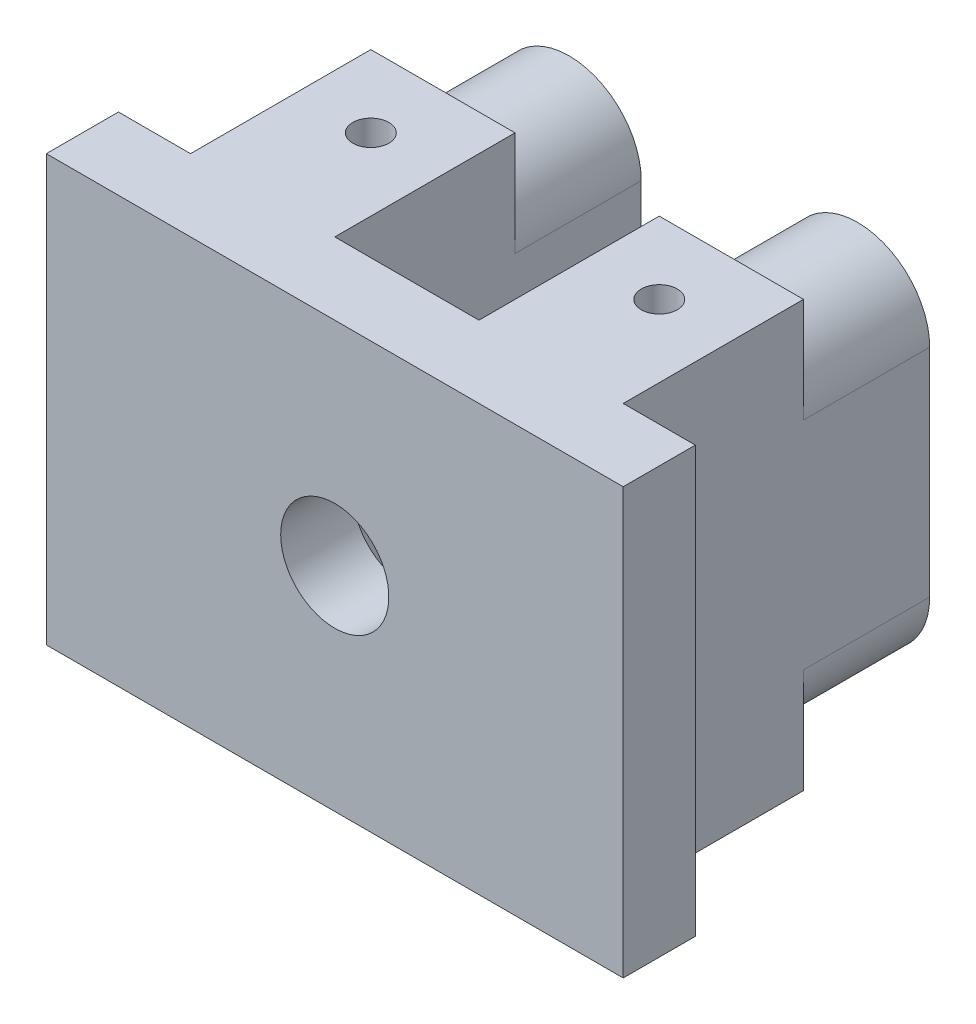
from build123d import *

# Parameters (mm, degrees)
BOSS_EXTRUDE1_DEPTH     = 11.8
BOSS_EXTRUDE2_DEPTH     = 10.5
CUT_EXTRUDE1_DEPTH      = 18.705648816
CUT_EXTRUDE1_DEPTH_BACK = 18.705648816
SKETCH2_R               = 0.5
SKETCH5_R               = 1.1
CUT_EXTRUDE2_DEPTH      = 1
CUT_EXTRUDE3_DEPTH      = 17.597891432
CUT_EXTRUDE3_DEPTH_BACK = 17.597891432
SKETCH6_R               = 1.5


with BuildPart() as part:
    # Sketch1 → Boss-Extrude1 (new body)
    with BuildSketch(Plane(origin=(0, 0, 0), x_dir=(1, 0, 0), z_dir=(0, 1, 0))):
        Polygon((0, 0), (8, 0), (8, 2), (6, 2), (6, 7), (2, 7), (2, 2), (-2, 2), (-2, 7), (-6, 7), (-6, 2), (-8, 2), (-8, 0), align=None)
    extrude(amount=BOSS_EXTRUDE1_DEPTH)

    # Sketch4 → Boss-Extrude2 (add)
    with BuildSketch(Plane.XY):
        with BuildLine():
            Line((-2, 8.9), (-2, 2.9))
            ThreePointArc((-2, 2.9), (-4, 0.9), (-6, 2.9))
            Line((-6, 2.9), (-6, 8.9))
            ThreePointArc((-6, 8.9), (-4, 10.9), (-2, 8.9))
        make_face()
        with BuildLine():
            Line((6, 8.9), (6, 2.9))
            ThreePointArc((6, 2.9), (4, 0.9), (2, 2.9))
            Line((2, 2.9), (2, 8.9))
            ThreePointArc((2, 8.9), (4, 10.9), (6, 8.9))
        make_face()
    extrude(amount=-BOSS_EXTRUDE2_DEPTH)

    # Sketch2 → Cut-Extrude1 (cut, two sides: drawn at the far end of the back side and taken through both)
    with BuildSketch(Plane(origin=(0, 11.8, 0), x_dir=(1, 0, 0), z_dir=(0, 1, 0)).offset(-CUT_EXTRUDE1_DEPTH_BACK)):
        with Locations(Location((-4, 5, 0), (0, 0, 270))):
            Circle(SKETCH2_R)
        with Locations(Location((4, 5, 0), (0, 0, 270))):
            Circle(SKETCH2_R)
    extrude(amount=CUT_EXTRUDE1_DEPTH + CUT_EXTRUDE1_DEPTH_BACK, mode=Mode.SUBTRACT)

    # Sketch5 → Cut-Extrude2 (cut)
    with BuildSketch(Plane(origin=(0, 0, -10.5), x_dir=(-1, 0, 0), z_dir=(0, 0, -1))):
        with Locations((4, 8.9)):
            Circle(SKETCH5_R)
        with Locations((4, 2.9)):
            Circle(SKETCH5_R)
        with Locations((-4, 2.9)):
            Circle(SKETCH5_R)
        with Locations((-4, 8.9)):
            Circle(SKETCH5_R)
    extrude(amount=-CUT_EXTRUDE2_DEPTH, mode=Mode.SUBTRACT)

    # Sketch6 → Cut-Extrude3 (cut, two sides: drawn at the far end of the back side and taken through both)
    with BuildSketch(Plane(origin=(0, 0, -2), x_dir=(-1, 0, 0), z_dir=(0, 0, -1)).offset(-CUT_EXTRUDE3_DEPTH_BACK)):
        with Locations((0, 5.9)):
            Circle(SKETCH6_R)
    extrude(amount=CUT_EXTRUDE3_DEPTH + CUT_EXTRUDE3_DEPTH_BACK, mode=Mode.SUBTRACT)


solid = part.part
